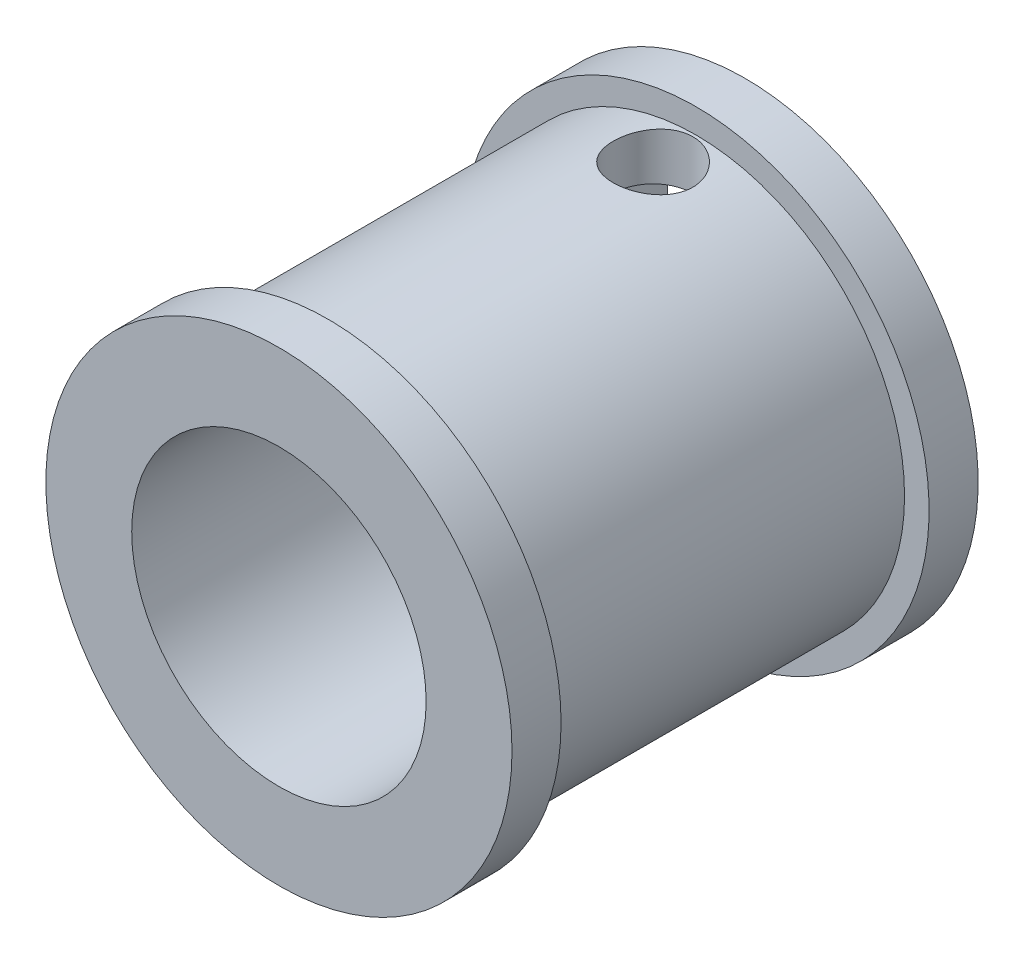
from build123d import *

# Parameters (mm, degrees)
CROQUIS1_R                 = 8.5
SALIENTE_EXTRUIR1_DEPTH    = 19
CORTAR_EXTRUIR1_DEPTH      = 23.483327156
CORTAR_EXTRUIR1_DEPTH_BACK = 23.483327156
CROQUIS2_R                 = 1.625
CROQUIS3_W                 = 6.34
CROQUIS3_H                 = 3
CORTAR_EXTRUIR2_DEPTH      = 7.5
CROQUIS4_R                 = 9.5
CROQUIS4_R_2               = 8.5
SALIENTE_EXTRUIR2_DEPTH    = 2
SALIENTE_EXTRUIR3_START    = -2
CROQUIS5_R                 = 9.5
CROQUIS5_R_2               = 8.5
SALIENTE_EXTRUIR3_DEPTH    = 2
CORTAR_EXTRUIR4_DEPTH      = 6.7
CORTAR_EXTRUIR4_DEPTH_BACK = 3
CROQUIS7_R                 = 1.625
CROQUIS9_R                 = 6
CORTAR_EXTRUIR5_DEPTH      = 9


with BuildPart() as part:
    # Croquis1 → Saliente-Extruir1 (new body)
    with BuildSketch(Plane.XY):
        Circle(CROQUIS1_R)
    extrude(amount=SALIENTE_EXTRUIR1_DEPTH)

    # Croquis2 → Cortar-Extruir1 (cut, two sides: drawn at the far end of the back side and taken through both)
    with BuildSketch(Plane(origin=(0, 0, 0), x_dir=(-1, 0, 0), z_dir=(0, 0, -1)).offset(-CORTAR_EXTRUIR1_DEPTH_BACK)):
        Circle(CROQUIS2_R)
    extrude(amount=CORTAR_EXTRUIR1_DEPTH + CORTAR_EXTRUIR1_DEPTH_BACK, mode=Mode.SUBTRACT)

    # Croquis3 → Cortar-Extruir2 (cut)
    with BuildSketch(Plane(origin=(0, 0, 0), x_dir=(-1, 0, 0), z_dir=(0, 0, -1))):
        with Locations((0, 5)):
            Rectangle(CROQUIS3_W, CROQUIS3_H)
    extrude(amount=-CORTAR_EXTRUIR2_DEPTH, mode=Mode.SUBTRACT)

    # Croquis4 → Saliente-Extruir2 (add)
    with BuildSketch(Plane(origin=(0, 0, 0), x_dir=(-1, 0, 0), z_dir=(0, 0, -1))):
        Circle(CROQUIS4_R)
        Circle(CROQUIS4_R_2, mode=Mode.SUBTRACT)
    extrude(amount=-SALIENTE_EXTRUIR2_DEPTH)

    # Croquis5 → Saliente-Extruir3 (add)
    with BuildSketch(Plane.XY.offset(19).offset(SALIENTE_EXTRUIR3_START)):
        with Locations(Location((0, 0, 0), (0, 0, 180))):
            Circle(CROQUIS5_R)
        with Locations(Location((0, 0, 0), (0, 0, 180))):
            Circle(CROQUIS5_R_2, mode=Mode.SUBTRACT)
    extrude(amount=SALIENTE_EXTRUIR3_DEPTH)

    # Croquis7 → Cortar-Extruir4 (cut, two sides: drawn at the far end of the back side and taken through both)
    with BuildSketch(Plane.XZ.offset(-6.5).offset(-CORTAR_EXTRUIR4_DEPTH_BACK)):
        with Locations(Location((0, 3.75, 0), (0, 0, 90))):
            Circle(CROQUIS7_R)
    extrude(amount=CORTAR_EXTRUIR4_DEPTH + CORTAR_EXTRUIR4_DEPTH_BACK, mode=Mode.SUBTRACT)

    # Croquis9 → Cortar-Extruir5 (cut)
    with BuildSketch(Plane.XY.offset(19)):
        Circle(CROQUIS9_R)
    extrude(amount=-CORTAR_EXTRUIR5_DEPTH, mode=Mode.SUBTRACT)


solid = part.part
